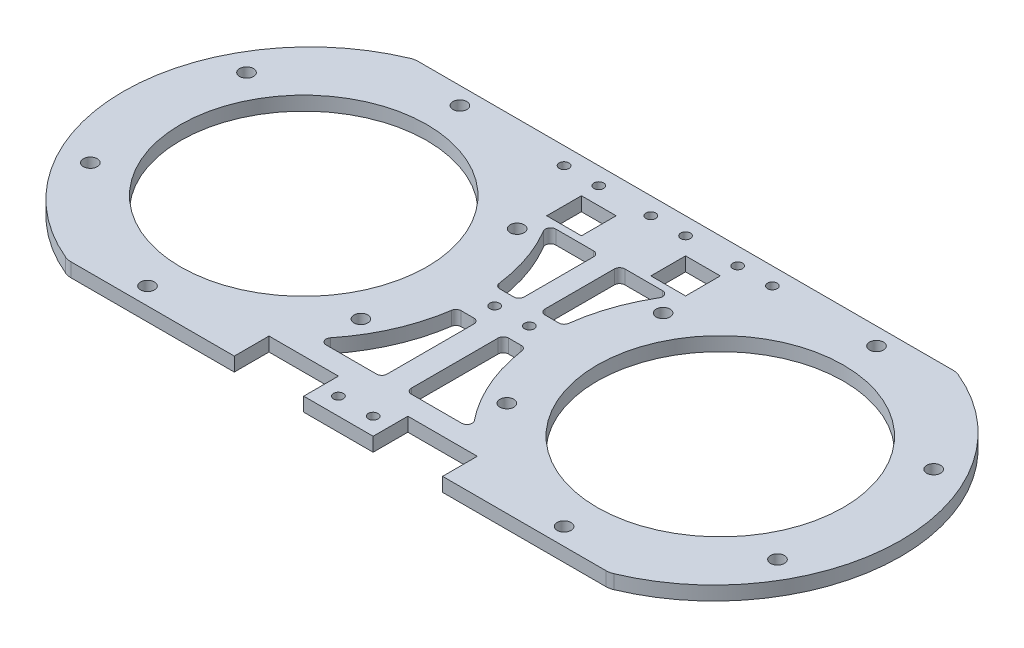
from build123d import *

# Parameters (mm, degrees)
SKETCH_1_R      = 35.5
SKETCH_1_R_2    = 2
SKETCH_1_R_3    = 1.4
SKETCH_1_W      = 10
SKETCH_1_H      = 10
EXTRUDE_1_DEPTH = 4


with BuildPart() as part:
    # 草图1 → 凸台-拉伸1 (new body)
    with BuildSketch(Plane(origin=(0, 0, 0), x_dir=(1, 0, 0), z_dir=(0, 1, 0))):
        with BuildLine():
            Line((-77.023496261, 50), (77.023496261, 50))
            ThreePointArc((77.023496261, 50), (78.005849606, 49.902548511), (78.949910233, 49.613992762))
            ThreePointArc((78.949910233, 49.613992762), (112, 0), (78.949910233, -49.613992762))
            ThreePointArc((78.949910233, -49.613992762), (78.005849606, -49.902548511), (77.023496261, -50))
            Line((77.023496261, -50), (30, -50))
            Line((30, -50), (30, -40))
            Line((30, -40), (10, -40))
            Line((10, -40), (10, -50))
            Line((10, -50), (-10, -50))
            Line((-10, -50), (-10, -40))
            Line((-10, -40), (-30, -40))
            Line((-30, -40), (-30, -50))
            Line((-30, -50), (-77.023496261, -50))
            ThreePointArc((-77.023496261, -50), (-78.005849606, -49.902548511), (-78.949910233, -49.613992762))
            ThreePointArc((-78.949910233, -49.613992762), (-112, 0), (-78.949910233, 49.613992762))
            ThreePointArc((-78.949910233, 49.613992762), (-78.005849606, 49.902548511), (-77.023496261, 50))
        make_face()
        with Locations(Location((60, 0, 0), (0, 0, 270))):
            Circle(SKETCH_1_R, mode=Mode.SUBTRACT)
        with Locations(Location((60, 45, 0), (0, 0, 270))):
            Circle(SKETCH_1_R_2, mode=Mode.SUBTRACT)
        with Locations(Location((21.02885683, 22.5, 0), (0, 0, 270))):
            Circle(SKETCH_1_R_2, mode=Mode.SUBTRACT)
        with Locations(Location((21.02885683, -22.5, 0), (0, 0, 270))):
            Circle(SKETCH_1_R_2, mode=Mode.SUBTRACT)
        with Locations(Location((60, -45, 0), (0, 0, 270))):
            Circle(SKETCH_1_R_2, mode=Mode.SUBTRACT)
        with Locations(Location((98.97114317, -22.5, 0), (0, 0, 270))):
            Circle(SKETCH_1_R_2, mode=Mode.SUBTRACT)
        with Locations(Location((98.97114317, 22.5, 0), (0, 0, 270))):
            Circle(SKETCH_1_R_2, mode=Mode.SUBTRACT)
        with Locations(Location((-60, 0, 0), (0, 0, 270))):
            Circle(SKETCH_1_R, mode=Mode.SUBTRACT)
        with Locations(Location((-98.97114317, -22.5, 0), (0, 0, 270))):
            Circle(SKETCH_1_R_2, mode=Mode.SUBTRACT)
        with Locations(Location((-98.97114317, 22.5, 0), (0, 0, 270))):
            Circle(SKETCH_1_R_2, mode=Mode.SUBTRACT)
        with Locations(Location((-60, 45, 0), (0, 0, 270))):
            Circle(SKETCH_1_R_2, mode=Mode.SUBTRACT)
        with Locations(Location((-21.02885683, 22.5, 0), (0, 0, 270))):
            Circle(SKETCH_1_R_2, mode=Mode.SUBTRACT)
        with Locations(Location((-21.02885683, -22.5, 0), (0, 0, 270))):
            Circle(SKETCH_1_R_2, mode=Mode.SUBTRACT)
        with Locations(Location((-60, -45, 0), (0, 0, 270))):
            Circle(SKETCH_1_R_2, mode=Mode.SUBTRACT)
        with Locations(Location((-5, 45, 0), (0, 0, 270))):
            Circle(SKETCH_1_R_3, mode=Mode.SUBTRACT)
        with Locations(Location((5, 45, 0), (0, 0, 270))):
            Circle(SKETCH_1_R_3, mode=Mode.SUBTRACT)
        with Locations(Location((5, -45, 0), (0, 0, 270))):
            Circle(SKETCH_1_R_3, mode=Mode.SUBTRACT)
        with Locations(Location((-5, -45, 0), (0, 0, 270))):
            Circle(SKETCH_1_R_3, mode=Mode.SUBTRACT)
        with Locations(Location((-5, 0, 0), (0, 0, 270))):
            Circle(SKETCH_1_R_3, mode=Mode.SUBTRACT)
        with Locations(Location((5, 0, 0), (0, 0, 270))):
            Circle(SKETCH_1_R_3, mode=Mode.SUBTRACT)
        with Locations(Location((20, 45, 0), (0, 0, 270))):
            Circle(SKETCH_1_R_3, mode=Mode.SUBTRACT)
        with Locations(Location((30, 45, 0), (0, 0, 270))):
            Circle(SKETCH_1_R_3, mode=Mode.SUBTRACT)
        with Locations(Location((-30, 45, 0), (0, 0, 270))):
            Circle(SKETCH_1_R_3, mode=Mode.SUBTRACT)
        with Locations(Location((-20, 45, 0), (0, 0, 270))):
            Circle(SKETCH_1_R_3, mode=Mode.SUBTRACT)
        with Locations((-15, 35)):
            Rectangle(SKETCH_1_W, SKETCH_1_H, mode=Mode.SUBTRACT)
        with Locations((15, 35)):
            Rectangle(SKETCH_1_W, SKETCH_1_H, mode=Mode.SUBTRACT)
        with BuildLine():
            Line((-15.375343139, 28), (-4.5, 28))
            ThreePointArc((-4.5, 28), (-3.439339828, 27.560660172), (-3, 26.5))
            Line((-3, 26.5), (-3, 6.5))
            ThreePointArc((-3, 6.5), (-3.439339828, 5.439339828), (-4.5, 5))
            Line((-4.5, 5), (-8.508641502, 5))
            ThreePointArc((-8.508641502, 5), (-9.500661686, 5.374879583), (-9.996831054, 6.312138728))
            ThreePointArc((-9.996831054, 6.312138728), (-12.331318269, 16.366330744), (-16.665073106, 25.734104046))
            ThreePointArc((-16.665073106, 25.734104046), (-16.678961935, 27.242009457), (-15.375343139, 28))
        make_face(mode=Mode.SUBTRACT)
        with BuildLine():
            Line((15.375343139, 28), (4.5, 28))
            ThreePointArc((4.5, 28), (3.439339828, 27.560660172), (3, 26.5))
            Line((3, 26.5), (3, 6.5))
            ThreePointArc((3, 6.5), (3.439339828, 5.439339828), (4.5, 5))
            Line((4.5, 5), (8.508641502, 5))
            ThreePointArc((8.508641502, 5), (9.500661686, 5.374879583), (9.996831054, 6.312138728))
            ThreePointArc((9.996831054, 6.312138728), (12.331318269, 16.366330744), (16.665073106, 25.734104046))
            ThreePointArc((16.665073106, 25.734104046), (16.678961935, 27.242009457), (15.375343139, 28))
        make_face(mode=Mode.SUBTRACT)
        with BuildLine():
            Line((-3.5, -7.5), (-3.5, -32.5))
            ThreePointArc((-3.5, -32.5), (-3.939339828, -33.560660172), (-5, -34))
            Line((-5, -34), (-19.535694742, -34))
            ThreePointArc((-19.535694742, -34), (-20.888277371, -33.148475313), (-20.705183333, -31.560693642))
            ThreePointArc((-20.705183333, -31.560693642), (-13.794118714, -20.128997357), (-10.129021878, -7.283236994))
            ThreePointArc((-10.129021878, -7.283236994), (-9.625800595, -6.36528759), (-8.644766576, -6))
            Line((-8.644766576, -6), (-5, -6))
            ThreePointArc((-5, -6), (-3.939339828, -6.439339828), (-3.5, -7.5))
        make_face(mode=Mode.SUBTRACT)
        with BuildLine():
            Line((5, -6), (8.644766576, -6))
            ThreePointArc((8.644766576, -6), (9.625800595, -6.36528759), (10.129021878, -7.283236994))
            ThreePointArc((10.129021878, -7.283236994), (13.794118714, -20.128997357), (20.705183333, -31.560693642))
            ThreePointArc((20.705183333, -31.560693642), (20.888277371, -33.148475313), (19.535694742, -34))
            Line((19.535694742, -34), (5, -34))
            ThreePointArc((5, -34), (3.939339828, -33.560660172), (3.5, -32.5))
            Line((3.5, -32.5), (3.5, -7.5))
            ThreePointArc((3.5, -7.5), (3.939339828, -6.439339828), (5, -6))
        make_face(mode=Mode.SUBTRACT)
    extrude(amount=EXTRUDE_1_DEPTH)


solid = part.part
